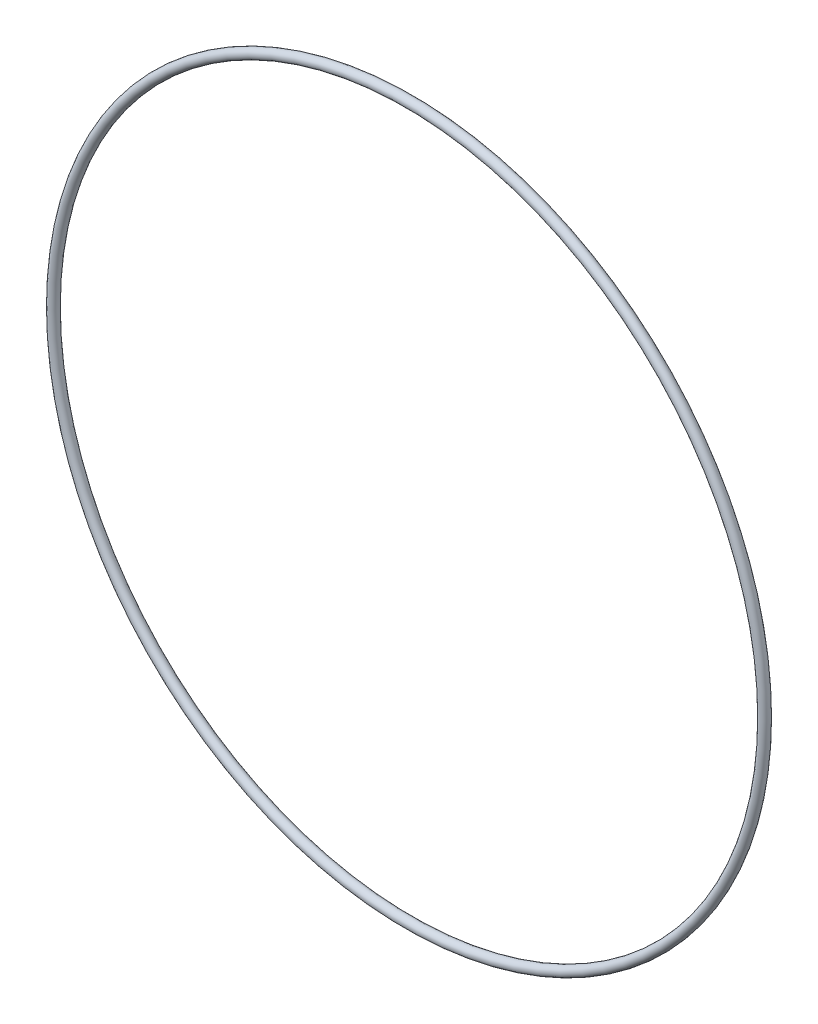
from build123d import *

# Parameters (mm, degrees)
SKETCH3_R = 1


with BuildPart() as part:
    # Sketch3 → Revolve1 (revolve)
    with BuildSketch(Plane(origin=(0, 0, 0), x_dir=(0, 0, -1), z_dir=(1, 0, 0))):
        with Locations((0, 72.5)):
            Circle(SKETCH3_R)
    revolve(axis=Axis((0, 0, 0), (0, 0, -1)))


solid = part.part
